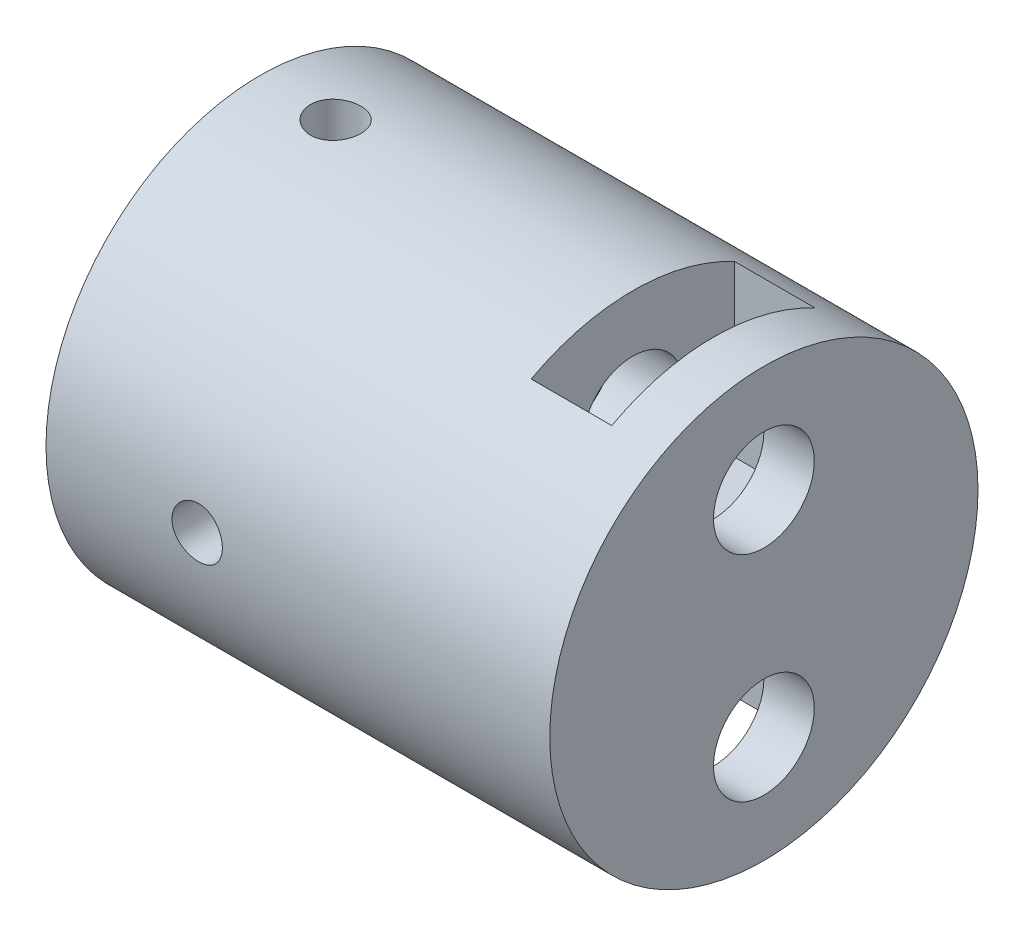
from build123d import *

# Parameters (mm, degrees)
SKETCH_1_R                      = 8.5
EXTRUDE_1_DEPTH                 = 20
SKETCH_2_R                      = 3.2
CUT_EXTRUDE_1_DEPTH             = 9
CUT_EXTRUDE_2_REACH             = 25.335
SKETCH_3_R                      = 1
CUT_EXTRUDE_2_DIRECTION_2_REACH = 25.335
CUT_EXTRUDE_3_DEPTH             = 21
CUT_EXTRUDE_3_DEPTH_BACK        = 19
SKETCH_4_R                      = 1
SKETCH_5_R                      = 2
CUT_EXTRUDE_4_DEPTH             = 8
CUT_EXTRUDE_6_DEPTH             = 3.2
SKETCH_10_W                     = 3.2
SKETCH_10_H                     = 8.08
CUT_EXTRUDE_8_DEPTH             = 7.75


with BuildPart() as part:
    # 草图1 → 凸台-拉伸1 (new body)
    with BuildSketch(Plane(origin=(0, 0, 0), x_dir=(0, 0, -1), z_dir=(1, 0, 0))):
        Circle(SKETCH_1_R)
    extrude(amount=EXTRUDE_1_DEPTH)

    # 草图2 → 切除-拉伸1 (cut)
    with BuildSketch(Plane.ZY):
        Circle(SKETCH_2_R)
    extrude(amount=-CUT_EXTRUDE_1_DEPTH, mode=Mode.SUBTRACT)

    # 草图3 → 切除-拉伸2 (cut, up to next)
    with BuildSketch(Plane(origin=(0, 0, 0), x_dir=(1, 0, 0), z_dir=(0, 1, 0)), mode=Mode.PRIVATE) as cut_extrude_2_sk1:
        with Locations(Location((3, 0, 0), (0, 0, 270))):
            Circle(SKETCH_3_R)
    cut_extrude_2_tool1 = extrude(cut_extrude_2_sk1.sketch, amount=-CUT_EXTRUDE_2_REACH, mode=Mode.PRIVATE) & part.part
    add(cut_extrude_2_tool1.solids().sort_by_distance((3, 0, 0))[0], mode=Mode.SUBTRACT)

    # 草图3 → 切除-拉伸2 direction 2 (cut, up to next)
    with BuildSketch(Plane(origin=(0, 0, 0), x_dir=(1, 0, 0), z_dir=(0, 1, 0)), mode=Mode.PRIVATE) as cut_extrude_2_direction_2_sk1:
        with Locations(Location((3, 0, 0), (0, 0, 270))):
            Circle(SKETCH_3_R)
    cut_extrude_2_direction_2_tool1 = extrude(cut_extrude_2_direction_2_sk1.sketch, amount=CUT_EXTRUDE_2_DIRECTION_2_REACH, mode=Mode.PRIVATE) & part.part
    add(cut_extrude_2_direction_2_tool1.solids().sort_by_distance((3, 0, 0))[0], mode=Mode.SUBTRACT)

    # 草图4 → 切除-拉伸3 (cut, two sides: drawn at the far end of the back side and taken through both)
    with BuildSketch(Plane.XY.offset(-CUT_EXTRUDE_3_DEPTH_BACK)):
        with Locations(Location((6, 0, 0), (0, 0, 180))):
            Circle(SKETCH_4_R)
    extrude(amount=CUT_EXTRUDE_3_DEPTH + CUT_EXTRUDE_3_DEPTH_BACK, mode=Mode.SUBTRACT)

    # 草图5 → 切除-拉伸4 (cut)
    with BuildSketch(Plane(origin=(20, 0, 0), x_dir=(0, 0, -1), z_dir=(1, 0, 0))):
        with Locations((0, 4.25)):
            Circle(SKETCH_5_R)
        with Locations((0, -4.25)):
            Circle(SKETCH_5_R)
    extrude(amount=-CUT_EXTRUDE_4_DEPTH, mode=Mode.SUBTRACT)

    # 草图8 → 切除-拉伸6 (cut)
    with BuildSketch(Plane(origin=(18, 0, 0), x_dir=(0, 0, -1), z_dir=(1, 0, 0))):
        Polygon((-4.041451884, 4.25), (-2.020725942, 0.75), (2.020725942, 0.75), (4.041451884, 4.25), (2.020725942, 7.75), (-2.020725942, 7.75), align=None)
        Polygon((4.041451884, -4.25), (2.020725942, -0.75), (-2.020725942, -0.75), (-4.041451884, -4.25), (-2.020725942, -7.75), (2.020725942, -7.75), align=None)
    extrude(amount=-CUT_EXTRUDE_6_DEPTH, mode=Mode.SUBTRACT)

    # 草图10 → 切除-拉伸8 (cut)
    with BuildSketch(Plane(origin=(0, 8.5, 0), x_dir=(1, 0, 0), z_dir=(0, 1, 0))):
        with Locations((16.4, 0)):
            Rectangle(SKETCH_10_W, SKETCH_10_H)
    cut_extrude_8 = extrude(amount=-CUT_EXTRUDE_8_DEPTH, mode=Mode.SUBTRACT)

    # 镜向1: 切除-拉伸8 across plane
    add(cut_extrude_8.mirror(Plane.ZX), mode=Mode.SUBTRACT)


solid = part.part
